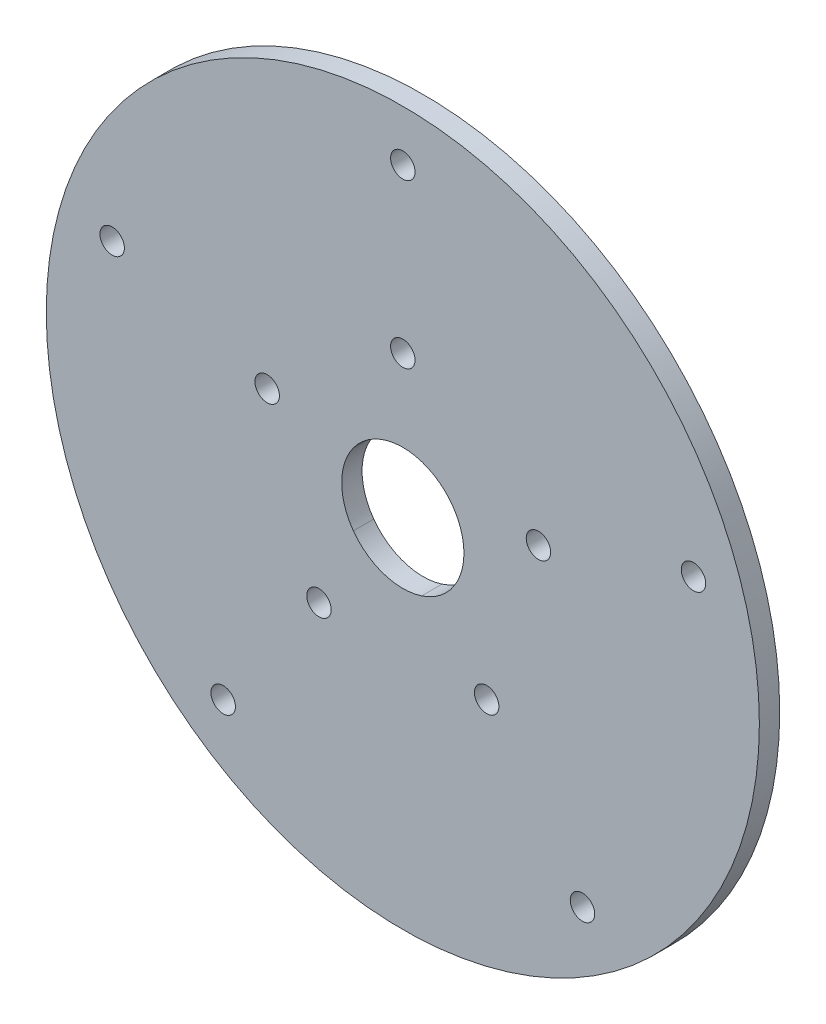
from build123d import *

# Parameters (mm, degrees)
SKETCH1_R           = 175
BOSS_EXTRUDE2_DEPTH = 10
SKETCH2_R           = 6
CUT_EXTRUDE1_DEPTH  = 248.68932153
CIRPATTERN2_COUNT   = 5


with BuildPart() as part:
    # Sketch1 → Boss-Extrude2 (new body)
    with BuildSketch(Plane.XY):
        Circle(SKETCH1_R)
        with BuildLine():
            ThreePointArc((30.001118034, 0.000363271), (24.271455118, -17.633432061), (9.271068846, -28.531513848))
            ThreePointArc((9.271068846, -28.531513848), (-9.270509831, -28.531695489), (-24.270855318, -17.633082037))
            ThreePointArc((-24.270855318, -17.633082037), (-30.000690983, 0.000951057), (-24.270855318, 17.63498415))
            ThreePointArc((-24.270855318, 17.63498415), (-9.270509831, 28.533597602), (9.271068846, 28.533415961))
            ThreePointArc((9.271068846, 28.533415961), (24.271455118, 17.635334174), (30.001118034, 0.001538842))
            ThreePointArc((30.001118034, 0.001538842), (30.001118028, 0.000951057), (30.001118011, 0.000363271))
        make_face(mode=Mode.SUBTRACT)
    extrude(amount=BOSS_EXTRUDE2_DEPTH)

    # Sketch2 → Cut-Extrude1 (cut, through all)
    with BuildSketch(Plane(origin=(0, 0, 0), x_dir=(-1, 0, 0), z_dir=(0, 0, -1))):
        with Locations((0, 70)):
            Circle(SKETCH2_R)
        with Locations((0, 150)):
            Circle(SKETCH2_R)
    cut_extrude1 = extrude(amount=-CUT_EXTRUDE1_DEPTH, mode=Mode.SUBTRACT)

    # CirPattern2: Cut-Extrude1 ×5 about axis
    cirpattern2_axis = Axis((0, 0, 0), (0, 0, 1))
    for i in range(1, CIRPATTERN2_COUNT):
        add(cut_extrude1.rotate(cirpattern2_axis, i * 360 / CIRPATTERN2_COUNT), mode=Mode.SUBTRACT)


solid = part.part
